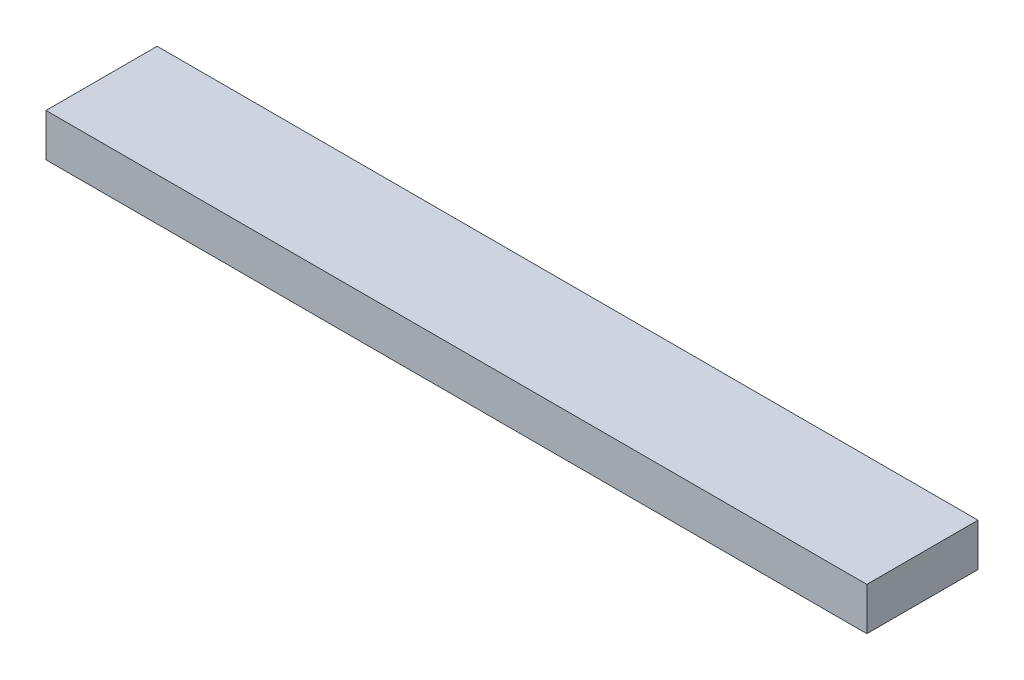
from build123d import *

# Parameters (mm, degrees)
SKETCH1_W           = 60.96
SKETCH1_H           = 8.255
BOSS_EXTRUDE1_DEPTH = 3.175


with BuildPart() as part:
    # Sketch1 → Boss-Extrude1 (new body)
    with BuildSketch(Plane(origin=(0, 0, 0), x_dir=(1, 0, 0), z_dir=(0, 1, 0))):
        with Locations((30.48, 4.1275)):
            Rectangle(SKETCH1_W, SKETCH1_H)
    extrude(amount=BOSS_EXTRUDE1_DEPTH)


solid = part.part
